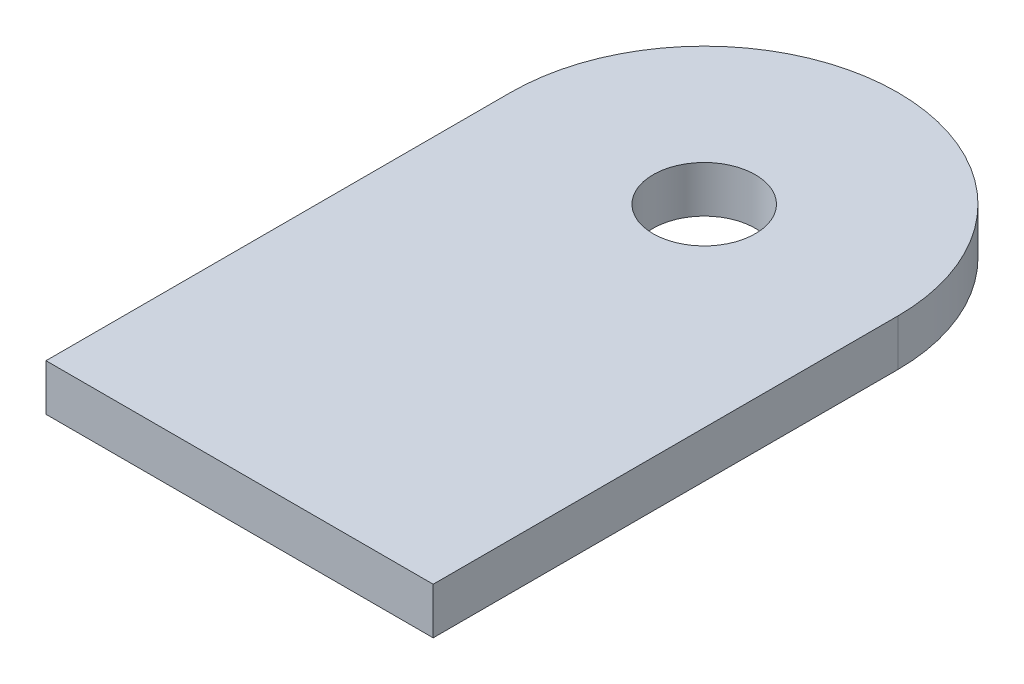
from build123d import *

# Parameters (mm, degrees)
SKETCH1_R           = 12.5
SKETCH1_R_2         = 3.302
BOSS_EXTRUDE1_DEPTH = 3


with BuildPart() as part:
    # Sketch1 → Boss-Extrude1 (new body)
    # profile 1 of 2: a face of its own
    with BuildSketch(Plane(origin=(0, 0, 0), x_dir=(1, 0, 0), z_dir=(0, 1, 0))):
        with BuildLine():
            ThreePointArc((2.22, 39.797498044), (-10.28, 27.297498044), (-22.78, 39.797498044))
            Line((-22.78, 39.797498044), (-22.78, 9.797498044))
            Line((-22.78, 9.797498044), (2.22, 9.797498044))
            Line((2.22, 9.797498044), (2.22, 39.797498044))
        make_face()
    # profile 2 of 2: a face of its own
    with BuildSketch(Plane(origin=(0, 0, 0), x_dir=(1, 0, 0), z_dir=(0, 1, 0))):
        with Locations((-10.28, 39.797498044)):
            Circle(SKETCH1_R)
        with Locations(Location((-10.28, 39.797498044, 0), (0, 0, 270))):
            Circle(SKETCH1_R_2, mode=Mode.SUBTRACT)
    extrude(amount=BOSS_EXTRUDE1_DEPTH)


solid = part.part
